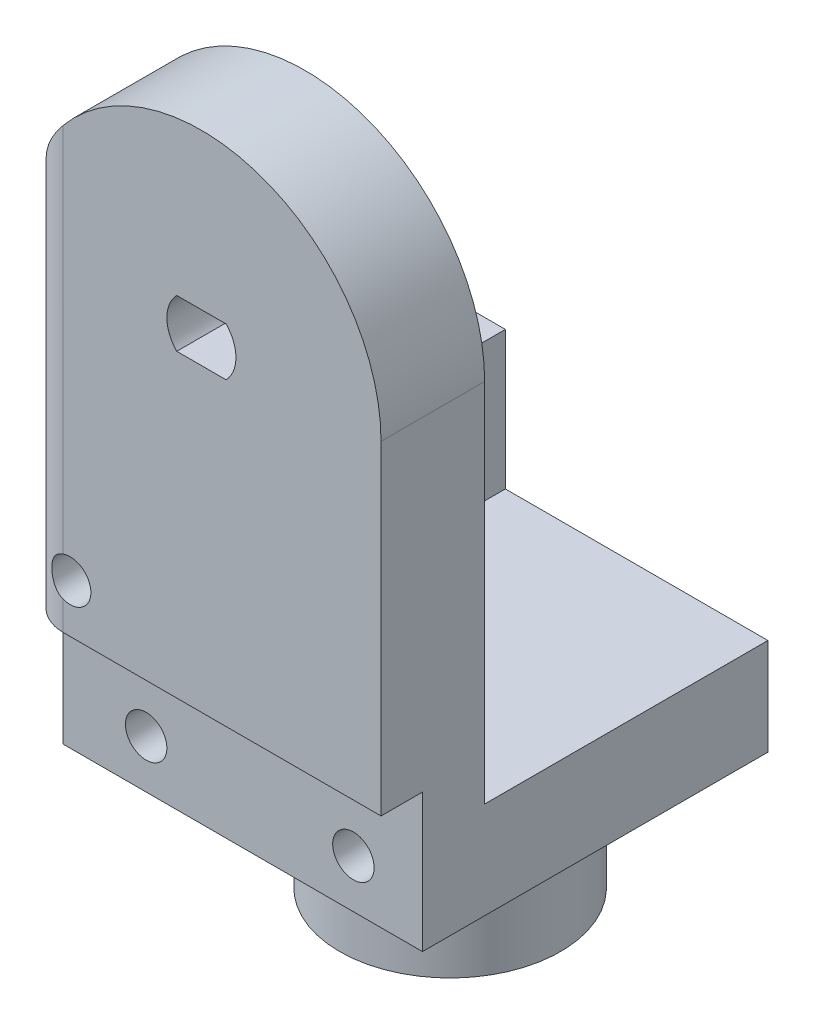
from build123d import *

# Parameters (mm, degrees)
SKETCH1_W           = 26
SKETCH1_H           = 50
BOSS_EXTRUDE1_DEPTH = 8
SKETCH2_W           = 26
SKETCH2_H           = 50
BOSS_EXTRUDE2_DEPTH = 8
SKETCH3_W           = 26
SKETCH3_H           = 7
BOSS_EXTRUDE3_DEPTH = 36
SKETCH4_R           = 8
SKETCH4_R_2         = 5
BOSS_EXTRUDE4_DEPTH = 10
FILLET2_R           = 3
SKETCH6_W           = 7
SKETCH6_H           = 17
BOSS_EXTRUDE5_DEPTH = 20
CHAMFER1_SIZE       = 2
CUT_EXTRUDE2_DEPTH  = 0.5
CUT_EXTRUDE3_DEPTH  = 0.5
CUT_EXTRUDE4_START  = -36
CUT_EXTRUDE4_DEPTH  = 36
SKETCH11_W          = 26
SKETCH11_H          = 10
CUT_EXTRUDE5_DEPTH  = 3
SKETCH12_W          = 26
SKETCH12_H          = 10
CUT_EXTRUDE6_DEPTH  = 3
CUT_EXTRUDE7_REACH  = 90.986
SKETCH13_R          = 1.5
SKETCH14_W          = 39.670907723
SKETCH14_H          = 70.738486061
CUT_EXTRUDE8_DEPTH  = 8


with BuildPart() as part:
    # Sketch1 → Boss-Extrude1 (new body)
    with BuildSketch(Plane.XY):
        with Locations((37.264100782, -29)):
            Rectangle(SKETCH1_W, SKETCH1_H)
        with BuildLine():
            Line((39.049457889, -22.265997948), (35.478743675, -22.265997948))
            ThreePointArc((35.478743675, -22.265997948), (34.764100782, -20.515997948), (35.478743675, -18.765997947))
            Line((35.478743675, -18.765997947), (39.049457889, -18.765997947))
            ThreePointArc((39.049457889, -18.765997947), (39.764100782, -20.515997948), (39.049457889, -22.265997948))
        make_face(mode=Mode.SUBTRACT)
    extrude(amount=BOSS_EXTRUDE1_DEPTH)



with BuildPart() as body_2:
    # Sketch2 → Boss-Extrude2 (new body)
    with BuildSketch(Plane(origin=(0, 0, -20), x_dir=(-1, 0, 0), z_dir=(0, 0, -1))):
        with Locations((-37.264100782, -29)):
            Rectangle(SKETCH2_W, SKETCH2_H)
        with BuildLine():
            Line((-39.049457889, -18.765997947), (-35.478743675, -18.765997947))
            ThreePointArc((-35.478743675, -18.765997947), (-34.764100782, -20.515997948), (-35.478743675, -22.265997948))
            Line((-35.478743675, -22.265997948), (-39.049457889, -22.265997948))
            ThreePointArc((-39.049457889, -22.265997948), (-39.764100782, -20.515997948), (-39.049457889, -18.765997947))
        make_face(mode=Mode.SUBTRACT)
    extrude(amount=BOSS_EXTRUDE2_DEPTH)


with BuildPart() as part_1:
    add(part.part)

    add(body_2.part)  # Boss-Extrude3 merges body 2
    # Sketch3 → Boss-Extrude3 (add)
    with BuildSketch(Plane.XY.offset(8)):
        with Locations((37.264100782, -50.5)):
            Rectangle(SKETCH3_W, SKETCH3_H)
    extrude(amount=-BOSS_EXTRUDE3_DEPTH)

    # Sketch4 → Boss-Extrude4 (add)
    with BuildSketch(Plane.XZ.offset(54)):
        with Locations(Location((37.264100782, -10, 0), (0, 0, 90))):
            Circle(SKETCH4_R)
        with Locations(Location((37.264100782, -10, 0), (0, 0, 270))):
            Circle(SKETCH4_R_2, mode=Mode.SUBTRACT)
    extrude(amount=BOSS_EXTRUDE4_DEPTH)

    # Fillet2
    fillet2_edges = [part_1.edges().sort_by_distance(p)[0] for p in [
        (24.264100782, -29, 8),
        (24.264100782, -29, -28),
    ]]
    fillet(fillet2_edges, radius=FILLET2_R)

    # Sketch6 → Boss-Extrude5 (add)
    with BuildSketch(Plane.XY.offset(-20)):
        with Locations((27.764100782, -45.5)):
            Rectangle(SKETCH6_W, SKETCH6_H)
    extrude(amount=BOSS_EXTRUDE5_DEPTH)

    # Chamfer1
    chamfer1_edges = [part_1.edges().sort_by_distance(p)[0] for p in [
        (37.264100782, -54, -18),
    ]]
    chamfer(chamfer1_edges, length=CHAMFER1_SIZE)

    # Sketch7 → Cut-Extrude2 (cut)
    with BuildSketch(Plane(origin=(0, 0, 0), x_dir=(-1, 0, 0), z_dir=(0, 0, -1))):
        Polygon((-50.264100782, -4), (-50.264100782, -47), (-31.264100782, -47), (-31.264100782, -37), (-24.264100782, -37), (-24.264100782, -4), align=None)
    extrude(amount=-CUT_EXTRUDE2_DEPTH, mode=Mode.SUBTRACT)

    # Sketch8 → Cut-Extrude3 (cut)
    with BuildSketch(Plane.XY.offset(-20)):
        Polygon((50.264100782, -47), (50.264100782, -4), (24.264100782, -4), (24.264100782, -37), (31.264100782, -37), (31.264100782, -47), align=None)
    extrude(amount=-CUT_EXTRUDE3_DEPTH, mode=Mode.SUBTRACT)

    # Sketch10 → Cut-Extrude4 (cut)
    with BuildSketch(Plane.XY.offset(8).offset(CUT_EXTRUDE4_START)):
        with BuildLine():
            Line((50.264100782, -20.515997948), (50.264100782, 2.26582648))
            Line((50.264100782, 2.26582648), (24.264100782, 2.26582648))
            Line((24.264100782, 2.26582648), (24.264100782, -20.515997948))
            ThreePointArc((24.264100782, -20.515997948), (37.264100782, -7.515997948), (50.264100782, -20.515997948))
        make_face()
    extrude(amount=CUT_EXTRUDE4_DEPTH, mode=Mode.SUBTRACT)

    # Sketch11 → Cut-Extrude5 (cut)
    with BuildSketch(Plane.XY.offset(8)):
        with Locations((37.264100782, -49)):
            Rectangle(SKETCH11_W, SKETCH11_H)
    extrude(amount=-CUT_EXTRUDE5_DEPTH, mode=Mode.SUBTRACT)

    # Sketch12 → Cut-Extrude6 (cut)
    with BuildSketch(Plane(origin=(0, 0, -28), x_dir=(-1, 0, 0), z_dir=(0, 0, -1))):
        with Locations((-37.264100782, -49)):
            Rectangle(SKETCH12_W, SKETCH12_H)
    extrude(amount=-CUT_EXTRUDE6_DEPTH, mode=Mode.SUBTRACT)

    # Cut-Extrude7: up to this face of the body (flat: up to its plane)
    cut_extrude7_end = Plane(part_1.part.faces().sort_by_distance((38.560022368, -26.898937337, -28))[0])
    # Sketch13 → Cut-Extrude7 (cut, up to the picked face)
    with BuildSketch(Plane.XY.offset(8), mode=Mode.PRIVATE) as cut_extrude7_sk1:
        with Locations((45.264100782, -50.5)):
            Circle(SKETCH13_R)
    cut_extrude7_tool1 = split(extrude(cut_extrude7_sk1.sketch, amount=-CUT_EXTRUDE7_REACH, mode=Mode.PRIVATE), bisect_by=cut_extrude7_end, keep=Keep.BOTH, mode=Mode.PRIVATE)
    # Sketch13 → Cut-Extrude7 (cut, up to the picked face)
    with BuildSketch(Plane.XY.offset(8), mode=Mode.PRIVATE) as cut_extrude7_sk2:
        with Locations((30.264100782, -50.5)):
            Circle(SKETCH13_R)
    cut_extrude7_tool2 = split(extrude(cut_extrude7_sk2.sketch, amount=-CUT_EXTRUDE7_REACH, mode=Mode.PRIVATE), bisect_by=cut_extrude7_end, keep=Keep.BOTH, mode=Mode.PRIVATE)
    # Sketch13 → Cut-Extrude7 (cut, up to the picked face)
    with BuildSketch(Plane.XY.offset(8), mode=Mode.PRIVATE) as cut_extrude7_sk3:
        with Locations(Location((27.764100782, -40.5, 0), (0, 0, 109.471220634))):
            Circle(SKETCH13_R)
    cut_extrude7_tool3 = split(extrude(cut_extrude7_sk3.sketch, amount=-CUT_EXTRUDE7_REACH, mode=Mode.PRIVATE), bisect_by=cut_extrude7_end, keep=Keep.BOTH, mode=Mode.PRIVATE)
    add(cut_extrude7_tool1.solids().sort_by(Axis((45.264101, -50.5, 8), (0, 0, -1)))[0], mode=Mode.SUBTRACT)
    add(cut_extrude7_tool2.solids().sort_by(Axis((30.264101, -50.5, 8), (0, 0, -1)))[0], mode=Mode.SUBTRACT)
    add(cut_extrude7_tool3.solids().sort_by(Axis((27.764101, -40.5, 8), (0, 0, -1)))[0], mode=Mode.SUBTRACT)

    # Sketch14 → Cut-Extrude8 (cut)
    with BuildSketch(Plane(origin=(0, 0, -28), x_dir=(-1, 0, 0), z_dir=(0, 0, -1))):
        with Locations((-35.76618016, -37.229796089)):
            Rectangle(SKETCH14_W, SKETCH14_H)
    extrude(amount=-CUT_EXTRUDE8_DEPTH, mode=Mode.SUBTRACT)


solid = part_1.part
